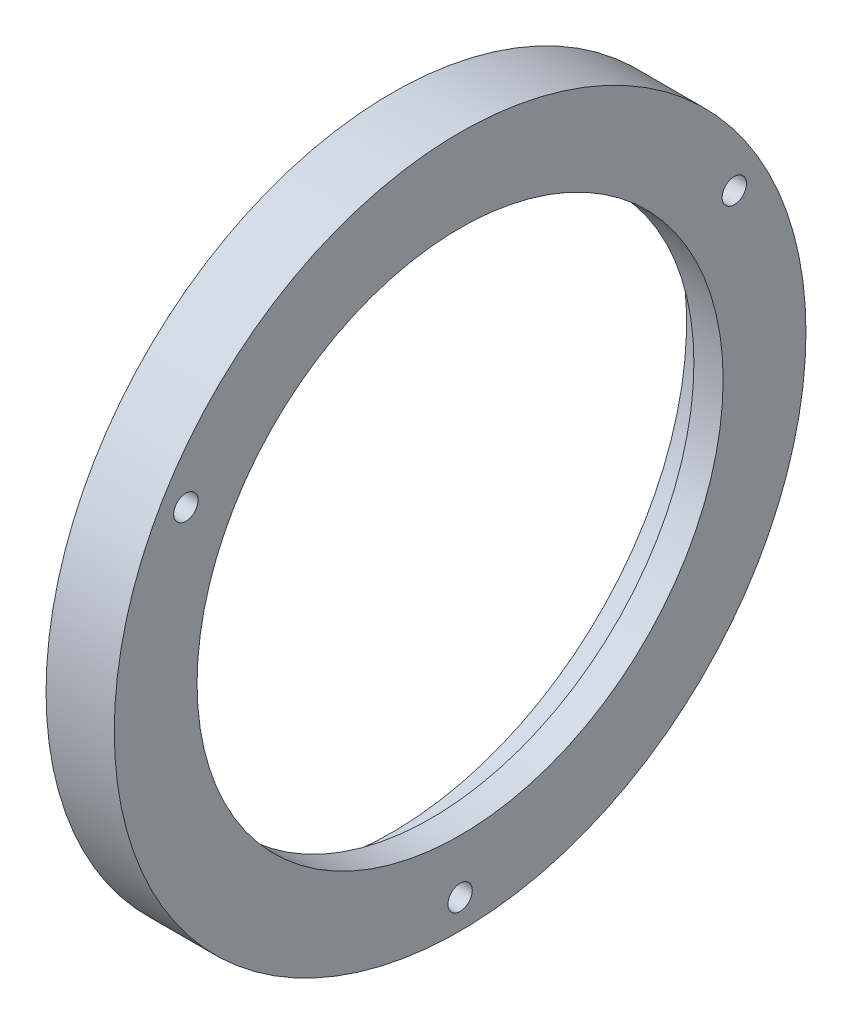
from build123d import *

# Parameters (mm, degrees)
AXIAL_HOLES_DEPTH      = 152.273890675
AXIAL_HOLES_DEPTH_BACK = 152.273890675
SKETCH2_R              = 1.25


with BuildPart() as part:
    # Axial profile (mm) → Full revolution (revolve)
    with BuildSketch(Plane.XY, mode=Mode.PRIVATE) as full_revolution_sk:
        Polygon((135.7, 30.25), (139.7, 30.25), (139.7, 27), (142.7, 27), (142.7, 35.5), (135.7, 35.5), align=None)
    revolve(full_revolution_sk.sketch.rotate(Axis((-110, 0, 0), (1, 0, 0)), 90), axis=Axis((-110, 0, 0), (1, 0, 0)))

    # Sketch2 → Axial holes (cut, two sides: drawn at the far end of the back side and taken through both)
    with BuildSketch(Plane(origin=(0, 0, 0), x_dir=(0, 0, -1), z_dir=(1, 0, 0)).offset(-AXIAL_HOLES_DEPTH_BACK)):
        with Locations((-28.145825623, 16.25)):
            Circle(SKETCH2_R)
        with Locations((0, -32.5)):
            Circle(SKETCH2_R)
        with Locations((28.145825623, 16.25)):
            Circle(SKETCH2_R)
    extrude(amount=AXIAL_HOLES_DEPTH + AXIAL_HOLES_DEPTH_BACK, mode=Mode.SUBTRACT)


solid = part.part
